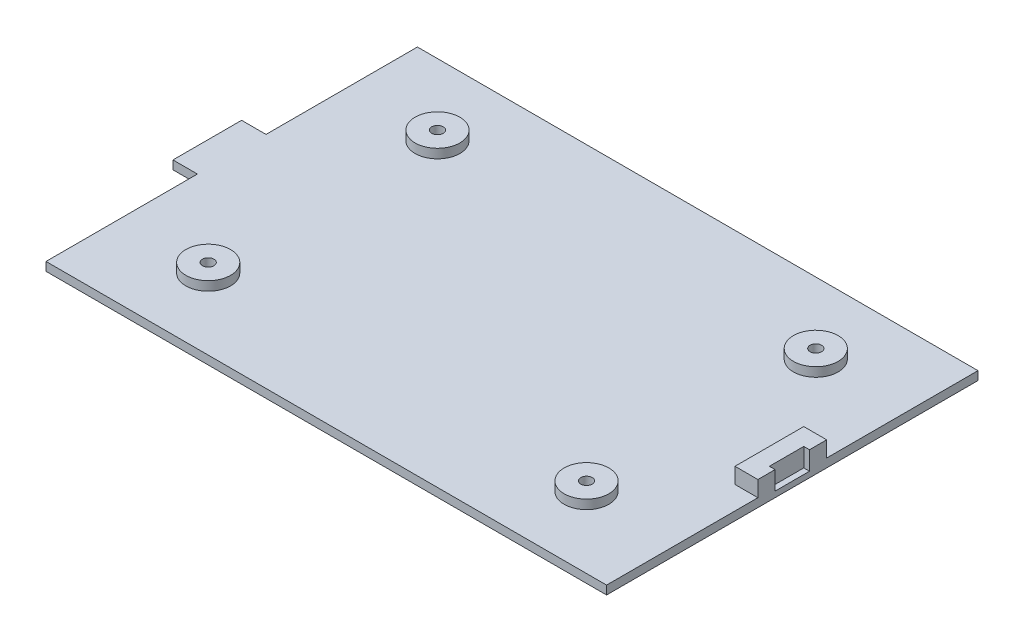
from build123d import *

# Parameters (mm, degrees)
EXTRUDE_1_DEPTH     = 1.5
SKETCH_2_R          = 5
CUT_EXTRUDE_1_DEPTH = 0.5
LED_3_START         = -4.25
LED_3_DEPTH         = 2.75
CUT_EXTRUDE_2_REACH = 76.153
SKETCH_15_R         = 2
EXTRUDE_START       = -3.1
SKETCH_16_R         = 3.9
SKETCH_16_R_2       = 1
EXTRUDE_4_DEPTH     = 1.6
LED_2_START         = -1.5
SKETCH_17_W         = 1
SKETCH_17_H         = 6
LED_2_DEPTH         = 0.5


with BuildPart() as part:
    # 草图1 → 凸台-拉伸1 (new body)
    with BuildSketch(Plane(origin=(0, 0, 0), x_dir=(1, 0, 0), z_dir=(0, 1, 0))):
        Polygon((-51.714401711, -10.060969859), (-55.976720774, -10.060969859), (-55.976720774, -22.035569809), (-51.714401711, -22.035569809), (-51.714401711, -48.448269834), (46.085598289, -48.448269834), (46.085598289, 16.351730166), (-51.714401711, 16.351730166), align=None)
    extrude(amount=EXTRUDE_1_DEPTH)

    # 草图2 → 防滑切除-拉伸1 (cut)
    with BuildSketch(Plane.XZ):
        with Locations(Location((-35.814401712, 36.048269834, 0), (0, 0, 270))):
            Circle(SKETCH_2_R)
        with Locations(Location((30.185598288, -3.951730166, 0), (0, 0, 90))):
            Circle(SKETCH_2_R)
        with Locations(Location((-35.814401712, -3.951730166, 0), (0, 0, 270))):
            Circle(SKETCH_2_R)
        with Locations(Location((30.185598288, 36.048269834, 0), (0, 0, 270))):
            Circle(SKETCH_2_R)
    extrude(amount=-CUT_EXTRUDE_1_DEPTH, mode=Mode.SUBTRACT)

    # 草图14 → LED限位凸台-拉伸3 (add)
    with BuildSketch(Plane.XZ.offset(LED_3_START)):
        Polygon((45.085598289, 13.048269834), (45.085598289, 19.048269834), (46.085598289, 19.048269834), (46.085598289, 22.048269834), (42.085598289, 22.048269834), (42.085598289, 10.048269834), (46.085598289, 10.048269834), (46.085598289, 13.048269834), align=None)
    extrude(amount=LED_3_DEPTH)

    # 草图15 → 螺丝孔位切除-拉伸2 (cut, up to next)
    with BuildSketch(Plane.XZ, mode=Mode.PRIVATE) as cut_extrude_2_sk1:
        with Locations(Location((-35.814401712, 36.048269834, 0), (0, 0, 270))):
            Circle(SKETCH_15_R)
    cut_extrude_2_tool1 = extrude(cut_extrude_2_sk1.sketch, amount=-CUT_EXTRUDE_2_REACH, mode=Mode.PRIVATE) & part.part
    # 草图15 → 螺丝孔位切除-拉伸2 (cut, up to next)
    with BuildSketch(Plane.XZ, mode=Mode.PRIVATE) as cut_extrude_2_sk2:
        with Locations(Location((30.185598288, 36.048269834, 0), (0, 0, 270))):
            Circle(SKETCH_15_R)
    cut_extrude_2_tool2 = extrude(cut_extrude_2_sk2.sketch, amount=-CUT_EXTRUDE_2_REACH, mode=Mode.PRIVATE) & part.part
    # 草图15 → 螺丝孔位切除-拉伸2 (cut, up to next)
    with BuildSketch(Plane.XZ, mode=Mode.PRIVATE) as cut_extrude_2_sk3:
        with Locations(Location((30.185598288, -3.951730166, 0), (0, 0, 90))):
            Circle(SKETCH_15_R)
    cut_extrude_2_tool3 = extrude(cut_extrude_2_sk3.sketch, amount=-CUT_EXTRUDE_2_REACH, mode=Mode.PRIVATE) & part.part
    # 草图15 → 螺丝孔位切除-拉伸2 (cut, up to next)
    with BuildSketch(Plane.XZ, mode=Mode.PRIVATE) as cut_extrude_2_sk4:
        with Locations(Location((-35.814401712, -3.951730166, 0), (0, 0, 270))):
            Circle(SKETCH_15_R)
    cut_extrude_2_tool4 = extrude(cut_extrude_2_sk4.sketch, amount=-CUT_EXTRUDE_2_REACH, mode=Mode.PRIVATE) & part.part
    add(cut_extrude_2_tool1.solids().sort_by_distance((-35.814402, 0, 36.04827))[0], mode=Mode.SUBTRACT)
    add(cut_extrude_2_tool2.solids().sort_by_distance((30.185598, 0, 36.04827))[0], mode=Mode.SUBTRACT)
    add(cut_extrude_2_tool3.solids().sort_by_distance((30.185598, 0, -3.95173))[0], mode=Mode.SUBTRACT)
    add(cut_extrude_2_tool4.solids().sort_by_distance((-35.814402, 0, -3.95173))[0], mode=Mode.SUBTRACT)

    # 草图16 → 螺丝孔凸台-拉伸4 (add)
    # profile 1 of 4: a face of its own
    with BuildSketch(Plane.XZ.offset(EXTRUDE_START)):
        with Locations(Location((-35.814401712, 36.048269834, 0), (0, 0, 180))):
            Circle(SKETCH_16_R)
        with Locations(Location((-35.814401712, 36.048269834, 0), (0, 0, 180))):
            Circle(SKETCH_16_R_2, mode=Mode.SUBTRACT)
    # profile 2 of 4: a face of its own
    with BuildSketch(Plane.XZ.offset(EXTRUDE_START)):
        with Locations(Location((30.185598288, 36.048269834, 0), (0, 0, 180))):
            Circle(SKETCH_16_R)
        with Locations(Location((30.185598288, 36.048269834, 0), (0, 0, 180))):
            Circle(SKETCH_16_R_2, mode=Mode.SUBTRACT)
    # profile 3 of 4: a face of its own
    with BuildSketch(Plane.XZ.offset(EXTRUDE_START)):
        with Locations(Location((30.185598288, -3.951730166, 0), (0, 0, 180))):
            Circle(SKETCH_16_R)
        with Locations(Location((30.185598288, -3.951730166, 0), (0, 0, 180))):
            Circle(SKETCH_16_R_2, mode=Mode.SUBTRACT)
    # profile 4 of 4: a face of its own
    with BuildSketch(Plane.XZ.offset(EXTRUDE_START)):
        with Locations(Location((-35.814401712, -3.951730166, 0), (0, 0, 180))):
            Circle(SKETCH_16_R)
        with Locations(Location((-35.814401712, -3.951730166, 0), (0, 0, 180))):
            Circle(SKETCH_16_R_2, mode=Mode.SUBTRACT)
    extrude(amount=EXTRUDE_4_DEPTH)

    # 草图17 → LED灯嵌入切除-拉伸2 (cut)
    with BuildSketch(Plane.XZ.offset(LED_2_START)):
        with Locations((45.585598289, 16.048269834)):
            Rectangle(SKETCH_17_W, SKETCH_17_H)
    extrude(amount=LED_2_DEPTH, mode=Mode.SUBTRACT)


solid = part.part
